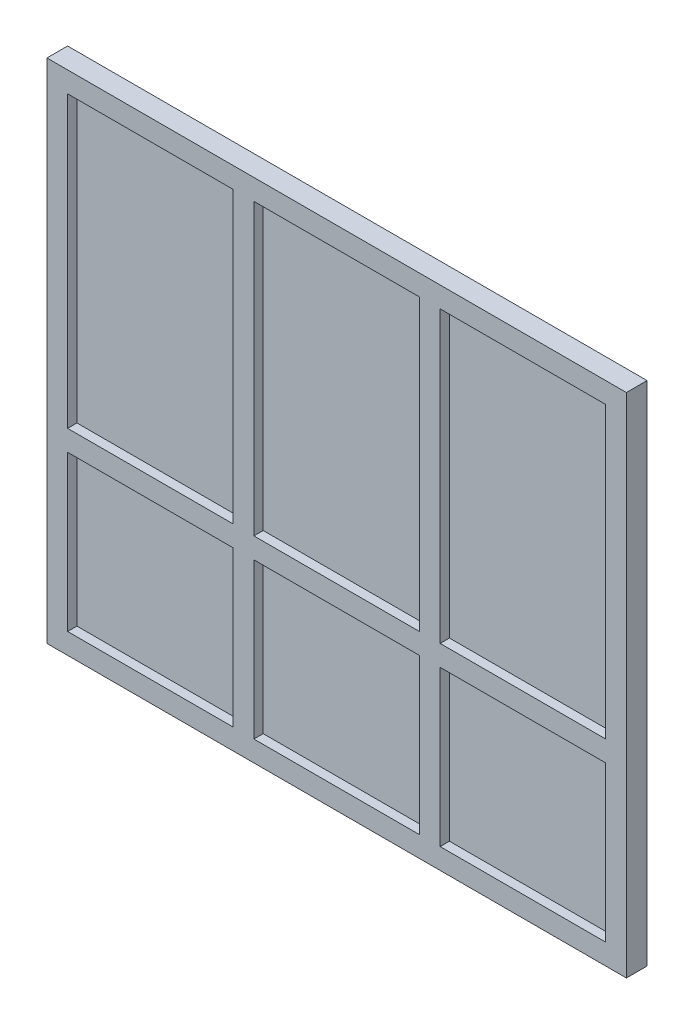
from build123d import *

# Parameters (mm, degrees)
SKETCH_1_W      = 2800
SKETCH_1_H      = 2450
SKETCH_1_W_2    = 800
SKETCH_1_H_2    = 1400
SKETCH_1_H_3    = 750
EXTRUDE_1_DEPTH = 100
SKETCH_2_W      = 2600
SKETCH_2_H      = 2250
EXTRUDE_2_DEPTH = 5


with BuildPart() as part:
    # Эскиз1 → Бобышка-Вытянуть1 (new body)
    with BuildSketch(Plane.XY):
        with Locations((0, 1225)):
            Rectangle(SKETCH_1_W, SKETCH_1_H)
        with Locations((-900, 1650)):
            Rectangle(SKETCH_1_W_2, SKETCH_1_H_2, mode=Mode.SUBTRACT)
        with Locations((-900, 475)):
            Rectangle(SKETCH_1_W_2, SKETCH_1_H_3, mode=Mode.SUBTRACT)
        with Locations((0, 1650)):
            Rectangle(SKETCH_1_W_2, SKETCH_1_H_2, mode=Mode.SUBTRACT)
        with Locations((0, 475)):
            Rectangle(SKETCH_1_W_2, SKETCH_1_H_3, mode=Mode.SUBTRACT)
        with Locations((900, 1650)):
            Rectangle(SKETCH_1_W_2, SKETCH_1_H_2, mode=Mode.SUBTRACT)
        with Locations((900, 475)):
            Rectangle(SKETCH_1_W_2, SKETCH_1_H_3, mode=Mode.SUBTRACT)
    extrude(amount=EXTRUDE_1_DEPTH)


with BuildPart() as body_2:
    # Эскиз2 → Бобышка-Вытянуть2 (new, symmetric)
    with BuildSketch(Plane(origin=(0, 0, 50), x_dir=(-1, 0, 0), z_dir=(0, 0, -1))):
        with Locations((0, 1225)):
            Rectangle(SKETCH_2_W, SKETCH_2_H)
    extrude(amount=EXTRUDE_2_DEPTH, both=True)


solid = Compound([part.part, body_2.part])
